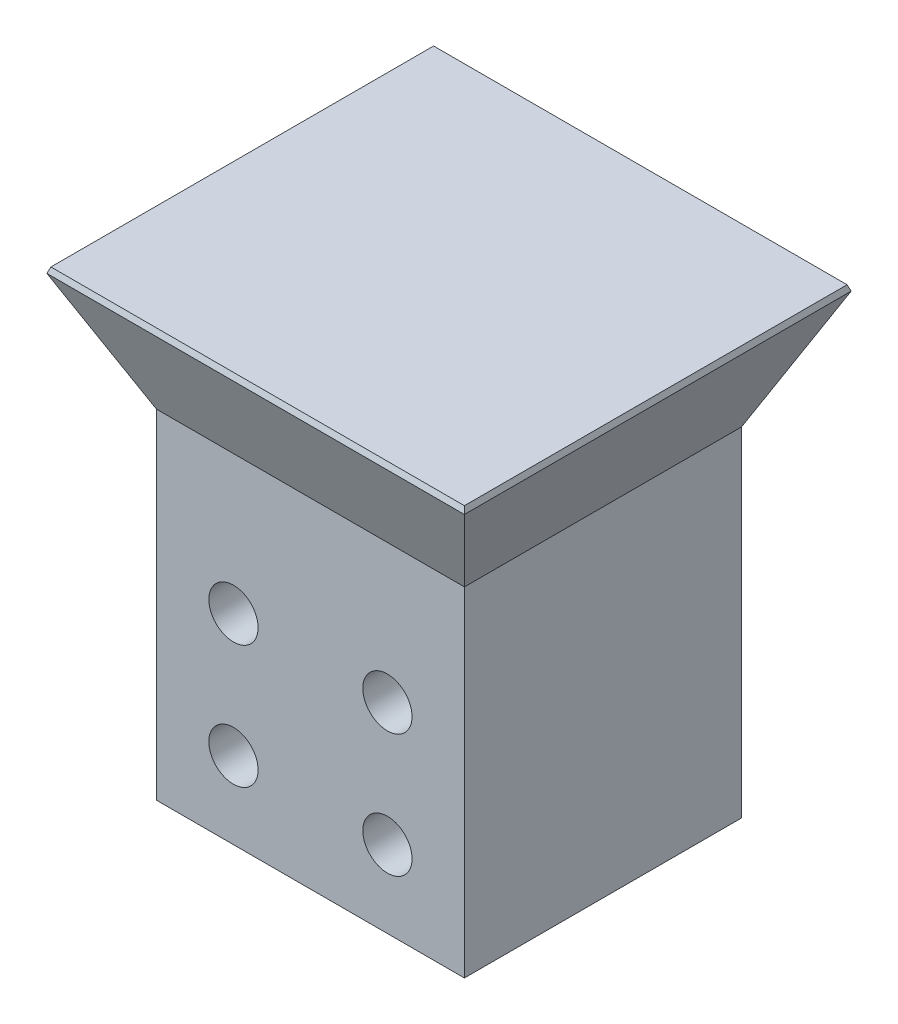
from build123d import *
from OCP.BRepFilletAPI import BRepFilletAPI_MakeChamfer

# Parameters (mm, degrees)
SKETCH1_W           = 20
SKETCH1_H           = 18
BOSS_EXTRUDE1_DEPTH = 22
SKETCH2_W           = 20
SKETCH2_H           = 18
BOSS_EXTRUDE2_DEPTH = 8
BOSS_EXTRUDE2_DRAFT = -25
SKETCH3_R           = 1.6
CUT_EXTRUDE1_DEPTH  = 40.506183229
CHAMFER1_SIZE       = 0.4
CHAMFER1_SIZE2      = 0.300994928


with BuildPart() as part:
    # Sketch1 → Boss-Extrude1 (new body)
    with BuildSketch(Plane(origin=(0, 0, 0), x_dir=(1, 0, 0), z_dir=(0, 1, 0))):
        Rectangle(SKETCH1_W, SKETCH1_H)
    extrude(amount=BOSS_EXTRUDE1_DEPTH)


with BuildPart() as boss_extrude2_tool:
    # Sketch2 → Boss-Extrude2 (with draft: the straight prism first)
    with BuildSketch(Plane(origin=(0, 22, 0), x_dir=(1, 0, 0), z_dir=(0, 1, 0))):
        Rectangle(SKETCH2_W, SKETCH2_H)
    extrude(amount=BOSS_EXTRUDE2_DEPTH)
    # Boss-Extrude2: the draft: its side faces are tilted about the plane it starts from
    boss_extrude2_sides = [boss_extrude2_tool.faces().sort_by_distance(p)[0] for p in [
        (10, 26, 0),
        (0, 26, -9),
        (-10, 26, 0),
        (0, 26, 9),
    ]]
    draft(boss_extrude2_sides, Plane(origin=(0, 22, 0), x_dir=(1, 0, 0), z_dir=(0, 1, 0)), BOSS_EXTRUDE2_DRAFT)


with BuildPart() as part_1:
    add(part.part)

    # Boss-Extrude2: add boss_extrude2_tool
    add(boss_extrude2_tool.part)

    # Sketch3 → Cut-Extrude1 (cut, through all)
    with BuildSketch(Plane.XY.offset(9)):
        with Locations((-5, 13)):
            Circle(SKETCH3_R)
        with Locations((5, 13)):
            Circle(SKETCH3_R)
        with Locations((-5, 5)):
            Circle(SKETCH3_R)
        with Locations((5, 5)):
            Circle(SKETCH3_R)
    extrude(amount=-CUT_EXTRUDE1_DEPTH, mode=Mode.SUBTRACT)

    # Chamfer1: one chamfer whose edges measure the first distance from different faces: ONE call of the kernel's chamfer builder (chamfer() names one face for all edges)
    chamfer1_edges_1 = [part_1.edges().sort_by_distance(p)[0] for p in [
        (0, 30, 12.730461265),
    ]]
    chamfer1_side_1 = [part_1.faces().sort_by_distance(p)[0] for p in [
        (0, 26.20960184, 10.962969576),
    ]]
    chamfer1_edges_2 = [part_1.edges().sort_by_distance(p)[0] for p in [
        (13.730461265, 30, 0),
    ]]
    chamfer1_side_2 = [part_1.faces().sort_by_distance(p)[0] for p in [
        (11.971965146, 26.228892903, 0),
    ]]
    chamfer1_edges_3 = [part_1.edges().sort_by_distance(p)[0] for p in [
        (0, 30, -12.730461265),
    ]]
    chamfer1_side_3 = [part_1.faces().sort_by_distance(p)[0] for p in [
        (0, 26.20960184, -10.962969576),
    ]]
    chamfer1_edges_4 = [part_1.edges().sort_by_distance(p)[0] for p in [
        (-13.730461265, 30, 0),
    ]]
    chamfer1_side_4 = [part_1.faces().sort_by_distance(p)[0] for p in [
        (-11.971965146, 26.228892903, 0),
    ]]
    chamfer1 = BRepFilletAPI_MakeChamfer(part_1.part.solid().wrapped)
    for e in chamfer1_edges_1:
        chamfer1.Add(CHAMFER1_SIZE, CHAMFER1_SIZE2, e.wrapped, chamfer1_side_1[0].wrapped)  # the first distance lies on this face
    for e in chamfer1_edges_2:
        chamfer1.Add(CHAMFER1_SIZE, CHAMFER1_SIZE2, e.wrapped, chamfer1_side_2[0].wrapped)  # the first distance lies on this face
    for e in chamfer1_edges_3:
        chamfer1.Add(CHAMFER1_SIZE, CHAMFER1_SIZE2, e.wrapped, chamfer1_side_3[0].wrapped)  # the first distance lies on this face
    for e in chamfer1_edges_4:
        chamfer1.Add(CHAMFER1_SIZE, CHAMFER1_SIZE2, e.wrapped, chamfer1_side_4[0].wrapped)  # the first distance lies on this face
    add(Compound.cast(chamfer1.Shape()), mode=Mode.REPLACE)


solid = part_1.part
